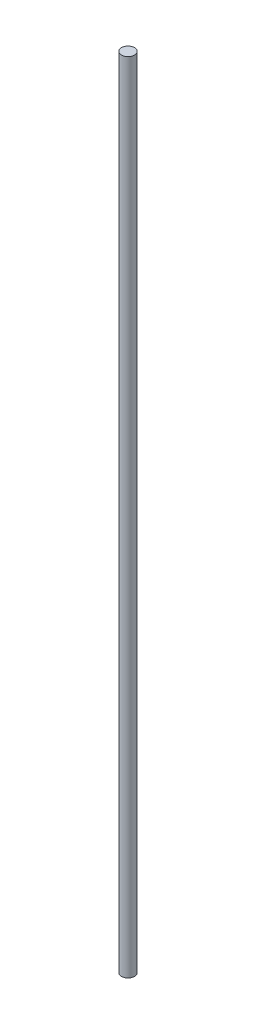
from build123d import *

# Parameters (mm, degrees)
SKETCH1_R           = 4
BOSS_EXTRUDE1_DEPTH = 490.56


with BuildPart() as part:
    # Sketch1 → Boss-Extrude1 (new body)
    with BuildSketch(Plane(origin=(0, 0, 0), x_dir=(1, 0, 0), z_dir=(0, 1, 0))):
        with Locations(Location((0, 0, 0), (0, 0, 270))):
            Circle(SKETCH1_R)
    extrude(amount=BOSS_EXTRUDE1_DEPTH)


solid = part.part
